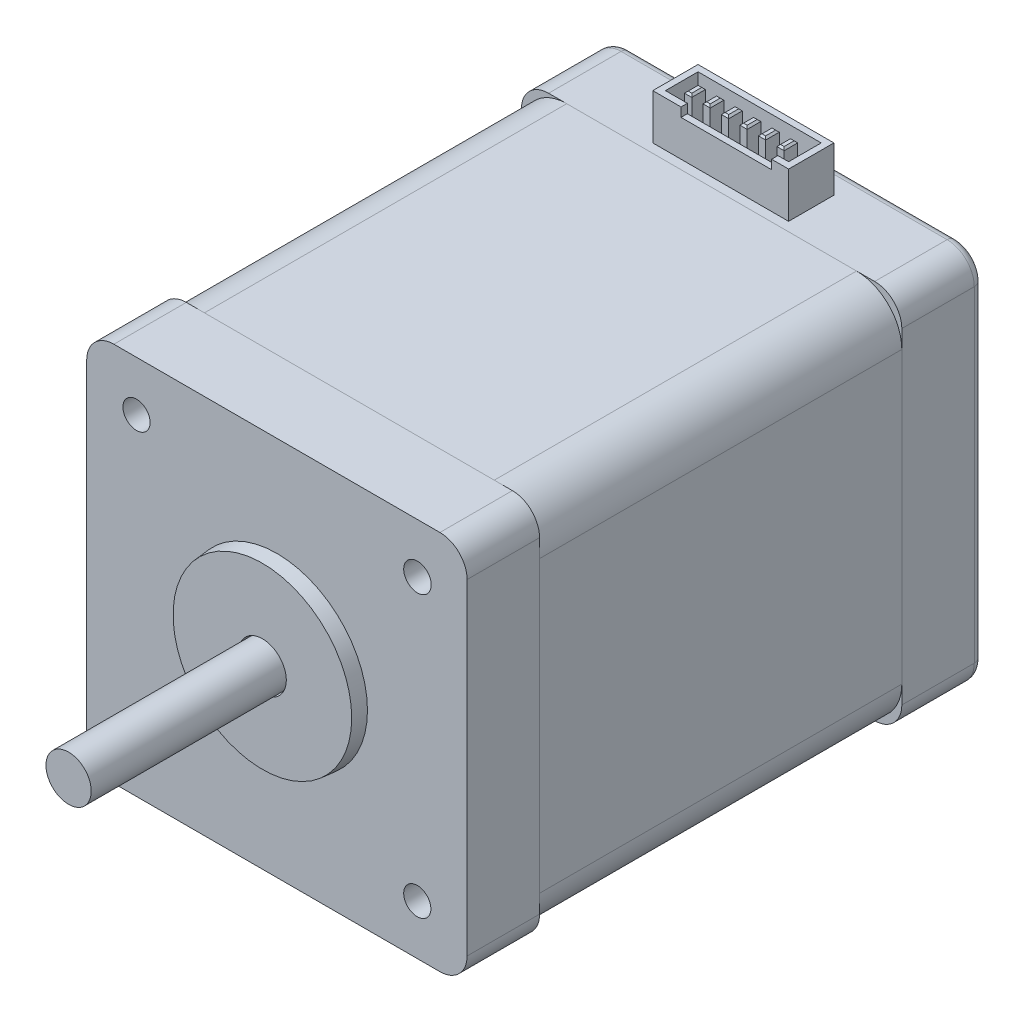
from build123d import *

# Parameters (mm, degrees)
SKETCH_1_R          = 1.5
EXTRUDE_1_DEPTH     = 8
SKETCH_4_R          = 2.5
EXTRUDE_2_DEPTH     = 23
SKETCH_9_W          = 42
SKETCH_9_H          = 42
EXTRUDE_7_DEPTH     = 40
SKETCH_10_W         = 42
SKETCH_10_H         = 42
EXTRUDE_8_DEPTH     = 9
FILLET_1_R          = 3
FILLET_2_R          = 5
SKETCH_12_R         = 1.5
SKETCH_12_R_2       = 1.518540069
CUT_EXTRUDE_1_DEPTH = 65.272855857
SKETCH_14_W         = 15
SKETCH_14_H         = 5
SKETCH_14_W_2       = 13.6
SKETCH_14_H_2       = 3.6
SKETCH_14_W_3       = 0.8
SKETCH_14_H_3       = 1.5
EXTRUDE_10_DEPTH    = 5
CHAMFER_1_SIZE      = 0.2
SKETCH_15_W         = 10
SKETCH_15_H         = 1
CUT_EXTRUDE_2_DEPTH = 0.7
FILLET_3_R          = 1
SKETCH_16_R         = 10
SKETCH_16_R_2       = 2.5
EXTRUDE_11_DEPTH    = 1.6
EXTRUDE_11_DRAFT    = 5


with BuildPart() as part:
    # 草图1 → 凸台-拉伸1 (new body)
    with BuildSketch(Plane.XY):
        with BuildLine():
            Line((-18, 21), (18, 21))
            ThreePointArc((18, 21), (20.121320344, 20.121320344), (21, 18))
            Line((21, 18), (21, -18))
            ThreePointArc((21, -18), (20.121320344, -20.121320344), (18, -21))
            Line((18, -21), (-18, -21))
            ThreePointArc((-18, -21), (-20.121320344, -20.121320344), (-21, -18))
            Line((-21, -18), (-21, 18))
            ThreePointArc((-21, 18), (-20.121320344, 20.121320344), (-18, 21))
        make_face()
        with Locations((-15.5, 15.5)):
            Circle(SKETCH_1_R, mode=Mode.SUBTRACT)
        with Locations(Location((15.5, 15.5, 0), (0, 0, 180))):
            Circle(SKETCH_1_R, mode=Mode.SUBTRACT)
        with Locations((15.5, -15.5)):
            Circle(SKETCH_1_R, mode=Mode.SUBTRACT)
        with Locations(Location((-15.5, -15.5, 0), (0, 0, 180))):
            Circle(SKETCH_1_R, mode=Mode.SUBTRACT)
    extrude(amount=EXTRUDE_1_DEPTH)

    # 草图4 → 凸台-拉伸2 (add)
    with BuildSketch(Plane.XY.offset(8)):
        with Locations(Location((0, 0, 0), (0, 0, 180))):
            Circle(SKETCH_4_R)
    extrude(amount=EXTRUDE_2_DEPTH)


with BuildPart() as body_2:
    # 草图9 → 凸台-拉伸7 (new body)
    with BuildSketch(Plane(origin=(0, 0, 0), x_dir=(-1, 0, 0), z_dir=(0, 0, -1))):
        Rectangle(SKETCH_9_W, SKETCH_9_H)
    extrude(amount=EXTRUDE_7_DEPTH)

    # 圆角2
    fillet_2_edges = [body_2.edges().sort_by_distance(p)[0] for p in [
        (-21, -21, -20),
        (21, -21, -20),
        (21, 21, -20),
        (-21, 21, -20),
    ]]
    fillet(fillet_2_edges, radius=FILLET_2_R)


with BuildPart() as body_3:
    # 草图10 → 凸台-拉伸8 (new body)
    with BuildSketch(Plane(origin=(0, 0, -40), x_dir=(-1, 0, 0), z_dir=(0, 0, -1))):
        Rectangle(SKETCH_10_W, SKETCH_10_H)
    extrude(amount=EXTRUDE_8_DEPTH)

    # 圆角1
    fillet_1_edges = [body_3.edges().sort_by_distance(p)[0] for p in [
        (21, 21, -44.5),
        (-21, 21, -44.5),
        (-21, -21, -44.5),
        (21, -21, -44.5),
    ]]
    fillet(fillet_1_edges, radius=FILLET_1_R)


with BuildPart() as cut_extrude_1_tool:
    # 草图12 → 切除-拉伸1 (new, through all)
    with BuildSketch(Plane.XY.offset(8)):
        with Locations((-15.5, 15.5)):
            Circle(SKETCH_12_R)
        with Locations((15.518540069, 15.5)):
            Circle(SKETCH_12_R_2)
        with Locations((-15.5, -15.5)):
            Circle(SKETCH_12_R)
        with Locations((15.5, -15.5)):
            Circle(SKETCH_12_R)
    extrude(amount=-CUT_EXTRUDE_1_DEPTH)


with BuildPart() as part_1:
    add(part.part)

    # 切除-拉伸1: cut by cut_extrude_1_tool
    add(cut_extrude_1_tool.part, mode=Mode.SUBTRACT)


with BuildPart() as body_2_1:
    add(body_2.part)

    # 切除-拉伸1: cut by cut_extrude_1_tool
    add(cut_extrude_1_tool.part, mode=Mode.SUBTRACT)


with BuildPart() as body_3_1:
    add(body_3.part)

    # 切除-拉伸1: cut by cut_extrude_1_tool
    add(cut_extrude_1_tool.part, mode=Mode.SUBTRACT)

    # 草图14 → 凸台-拉伸10 (add)
    # profile 1 of 7: a face of its own
    with BuildSketch(Plane(origin=(0, 21, 0), x_dir=(1, 0, 0), z_dir=(0, 1, 0))):
        with Locations((0, 43.5)):
            Rectangle(SKETCH_14_W, SKETCH_14_H)
        with Locations((0, 43.5)):
            Rectangle(SKETCH_14_W_2, SKETCH_14_H_2, mode=Mode.SUBTRACT)
    # profile 2 of 7: a face of its own
    with BuildSketch(Plane(origin=(0, 21, 0), x_dir=(1, 0, 0), z_dir=(0, 1, 0))):
        with Locations((-5.3, 43.457329348)):
            Rectangle(SKETCH_14_W_3, SKETCH_14_H_3)
    # profile 3 of 7: a face of its own
    with BuildSketch(Plane(origin=(0, 21, 0), x_dir=(1, 0, 0), z_dir=(0, 1, 0))):
        with Locations((-1.22, 43.457329348)):
            Rectangle(SKETCH_14_W_3, SKETCH_14_H_3)
    # profile 4 of 7: a face of its own
    with BuildSketch(Plane(origin=(0, 21, 0), x_dir=(1, 0, 0), z_dir=(0, 1, 0))):
        with Locations((4.9, 43.457329348)):
            Rectangle(SKETCH_14_W_3, SKETCH_14_H_3)
    # profile 5 of 7: a face of its own
    with BuildSketch(Plane(origin=(0, 21, 0), x_dir=(1, 0, 0), z_dir=(0, 1, 0))):
        with Locations((2.86, 43.457329348)):
            Rectangle(SKETCH_14_W_3, SKETCH_14_H_3)
    # profile 6 of 7: a face of its own
    with BuildSketch(Plane(origin=(0, 21, 0), x_dir=(1, 0, 0), z_dir=(0, 1, 0))):
        with Locations((-3.26, 43.457329348)):
            Rectangle(SKETCH_14_W_3, SKETCH_14_H_3)
    # profile 7 of 7: a face of its own
    with BuildSketch(Plane(origin=(0, 21, 0), x_dir=(1, 0, 0), z_dir=(0, 1, 0))):
        with Locations((0.82, 43.457329348)):
            Rectangle(SKETCH_14_W_3, SKETCH_14_H_3)
    extrude(amount=EXTRUDE_10_DEPTH)

    # 倒角1
    chamfer_1_edges = [body_3_1.edges().sort_by_distance(p)[0] for p in [
        (5.3, 26, -43.457329348),
        (4.9, 26, -44.207329348),
        (4.5, 26, -43.457329348),
        (4.9, 26, -42.707329348),
        (3.26, 26, -43.457329348),
        (2.86, 26, -44.207329348),
        (2.46, 26, -43.457329348),
        (2.86, 26, -42.707329348),
        (-2.86, 26, -43.457329348),
        (-3.26, 26, -44.207329348),
        (-3.66, 26, -43.457329348),
        (-3.26, 26, -42.707329348),
        (1.22, 26, -43.457329348),
        (0.82, 26, -44.207329348),
        (0.42, 26, -43.457329348),
        (0.82, 26, -42.707329348),
        (-4.9, 26, -43.457329348),
        (-5.3, 26, -44.207329348),
        (-5.7, 26, -43.457329348),
        (-5.3, 26, -42.707329348),
        (-0.82, 26, -43.457329348),
        (-1.22, 26, -44.207329348),
        (-1.62, 26, -43.457329348),
        (-1.22, 26, -42.707329348),
    ]]
    chamfer(chamfer_1_edges, length=CHAMFER_1_SIZE)

    # 草图15 → 切除-拉伸2 (cut)
    with BuildSketch(Plane.XY.offset(-41)):
        with Locations((0.62, 25.5)):
            Rectangle(SKETCH_15_W, SKETCH_15_H)
    extrude(amount=-CUT_EXTRUDE_2_DEPTH, mode=Mode.SUBTRACT)

    # 圆角3
    fillet_3_edges = [body_3_1.edges().sort_by_distance(p)[0] for p in [
        (0, -21, -49),
        (21, 0, -49),
        (-21, 0, -49),
        (0, 21, -49),
        (20.121320344, 20.121320344, -49),
        (-20.121320344, 20.121320344, -49),
        (-20.121320344, -20.121320344, -49),
        (20.121320344, -20.121320344, -49),
    ]]
    fillet(fillet_3_edges, radius=FILLET_3_R)


with BuildPart() as extrude_11_tool:
    # 草图16 → 凸台-拉伸11 (with draft: the straight prism first)
    with BuildSketch(Plane.XY.offset(8)):
        Circle(SKETCH_16_R)
        Circle(SKETCH_16_R_2, mode=Mode.SUBTRACT)
    extrude(amount=EXTRUDE_11_DEPTH)
    # 凸台-拉伸11: the draft: its side faces are tilted about the plane it starts from
    extrude_11_sides = [extrude_11_tool.faces().sort_by_distance(p)[0] for p in [
        (-10, 0, 8.8),
        (-2.5, 0, 8.8),
    ]]
    draft(extrude_11_sides, Plane.XY.offset(8), EXTRUDE_11_DRAFT)


with BuildPart() as part_2:
    add(part_1.part)

    # 凸台-拉伸11: add extrude_11_tool
    add(extrude_11_tool.part)


solid = Compound([body_2_1.part, body_3_1.part, part_2.part])
